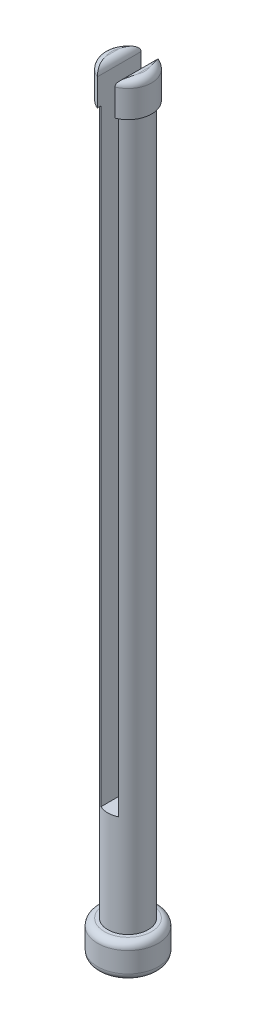
from build123d import *

# Parameters (mm, degrees)
SKETCH1_R           = 3
BOSS_EXTRUDE1_DEPTH = 110
SKETCH2_R           = 4.5
BOSS_EXTRUDE2_DEPTH = 5
FILLET1_R           = 1
BOSS_EXTRUDE3_START = -5
SKETCH3_R           = 3.5
SKETCH3_R_2         = 3
BOSS_EXTRUDE3_DEPTH = 5
CUT_EXTRUDE1_START  = -95
CUT_EXTRUDE1_DEPTH  = 95
FILLET2_R           = 1


with BuildPart() as part:
    # Sketch1 → Boss-Extrude1 (new body)
    with BuildSketch(Plane(origin=(0, 0, 0), x_dir=(1, 0, 0), z_dir=(0, 1, 0))):
        Circle(SKETCH1_R)
    extrude(amount=BOSS_EXTRUDE1_DEPTH)

    # Sketch2 → Boss-Extrude2 (add)
    with BuildSketch(Plane.XZ):
        Circle(SKETCH2_R)
    extrude(amount=BOSS_EXTRUDE2_DEPTH)

    # Fillet1
    fillet1_edges = [part.edges().sort_by_distance(p)[0] for p in [
        (-4.5, 0, 0),
        (-4.5, -5, 0),
    ]]
    fillet(fillet1_edges, radius=FILLET1_R)

    # Sketch3 → Boss-Extrude3 (add)
    with BuildSketch(Plane(origin=(0, 110, 0), x_dir=(1, 0, 0), z_dir=(0, 1, 0)).offset(BOSS_EXTRUDE3_START)):
        Circle(SKETCH3_R)
        Circle(SKETCH3_R_2, mode=Mode.SUBTRACT)
    extrude(amount=BOSS_EXTRUDE3_DEPTH)

    # Sketch4 → Cut-Extrude1 (cut)
    with BuildSketch(Plane(origin=(0, 110, 0), x_dir=(1, 0, 0), z_dir=(0, 1, 0)).offset(CUT_EXTRUDE1_START)):
        with BuildLine():
            Line((-1.3, 3.249615362), (-1.3, -3.249615362))
            ThreePointArc((-1.3, -3.249615362), (0, -3.5), (1.3, -3.249615362))
            Line((1.3, -3.249615362), (1.3, 3.249615362))
            ThreePointArc((1.3, 3.249615362), (0, 3.5), (-1.3, 3.249615362))
        make_face()
    extrude(amount=CUT_EXTRUDE1_DEPTH, mode=Mode.SUBTRACT)

    # Fillet2
    fillet2_edges = [part.edges().sort_by_distance(p)[0] for p in [
        (1.3, 110, 0),
        (-1.3, 110, 0),
        (3.5, 110, 0),
        (-3.5, 110, 0),
    ]]
    fillet(fillet2_edges, radius=FILLET2_R)


solid = part.part
